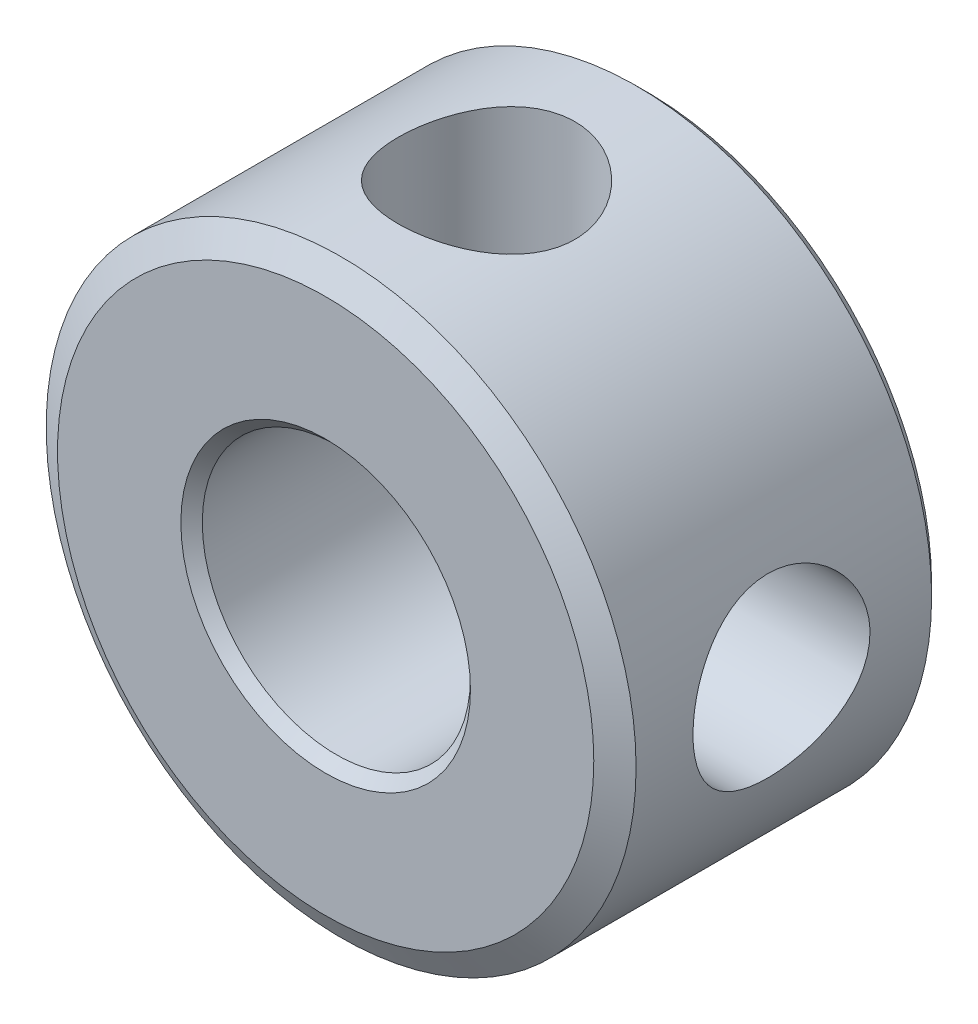
from build123d import *

# Parameters (mm, degrees)
SKETCH1_W           = 6
SKETCH1_H           = 3
TAPPED_HOLE1_REACH  = 15.684
TAPPED_HOLE1_BORE_R = 1.65
CIRPATTERN1_COUNT   = 2
CIRPATTERN1_ANGLE   = 90
CHAMFER1_SIZE       = 0.2


with BuildPart() as part:
    # Sketch1 → Revolve1 (revolve)
    with BuildSketch(Plane(origin=(0, 0, 0), x_dir=(0, 0, -1), z_dir=(1, 0, 0)), mode=Mode.PRIVATE) as revolve1_sk:
        with Locations((3, 4)):
            Rectangle(SKETCH1_W, SKETCH1_H)
    revolve(revolve1_sk.sketch.rotate(Axis((0, 0, 0), (0, 0, -1)), 90), axis=Axis((0, 0, 0), (0, 0, -1)))

    # Tapped Hole1 bore → Tapped Hole1 (cut, up to next)
    with BuildSketch(Plane(origin=(0, 5.5, 0), x_dir=(1, 0, 0), z_dir=(0, 1, 0)), mode=Mode.PRIVATE) as tapped_hole1_sk1:
        with Locations((0, 3)):
            Circle(TAPPED_HOLE1_BORE_R)
    tapped_hole1_tool1 = extrude(tapped_hole1_sk1.sketch, amount=-TAPPED_HOLE1_REACH, mode=Mode.PRIVATE) & part.part
    tapped_hole1 = tapped_hole1_tool1.solids().sort_by_distance((0, 5.5, -3))[0]
    add(tapped_hole1, mode=Mode.SUBTRACT)

    # CirPattern1: Tapped Hole1 ×2 about axis
    cirpattern1_axis = Axis((0, 0, 0), (0, 0, -1))
    for i in range(1, CIRPATTERN1_COUNT):
        add(tapped_hole1.rotate(cirpattern1_axis, i * CIRPATTERN1_ANGLE / (CIRPATTERN1_COUNT - 1)), mode=Mode.SUBTRACT)

    # Chamfer1
    chamfer1_edges = [part.edges().sort_by_distance(p)[0] for p in [
        (-2.5, 0, -6),
        (-2.5, 0, 0),
        (-5.5, 0, -6),
    ]]
    chamfer(chamfer1_edges, length=CHAMFER1_SIZE)

    # Sketch4 → Cut-Revolve1 (revolve, cut)
    with BuildSketch(Plane(origin=(0, 0, 0), x_dir=(0, 0, -1), z_dir=(1, 0, 0)), mode=Mode.PRIVATE) as cut_revolve1_sk:
        Polygon((0.288675135, 5.5), (0, 5), (0, 5.5), align=None)
    revolve(cut_revolve1_sk.sketch.rotate(Axis((0, 0, 0), (0, 0, -1)), 90), axis=Axis((0, 0, 0), (0, 0, -1)), mode=Mode.SUBTRACT)


solid = part.part
